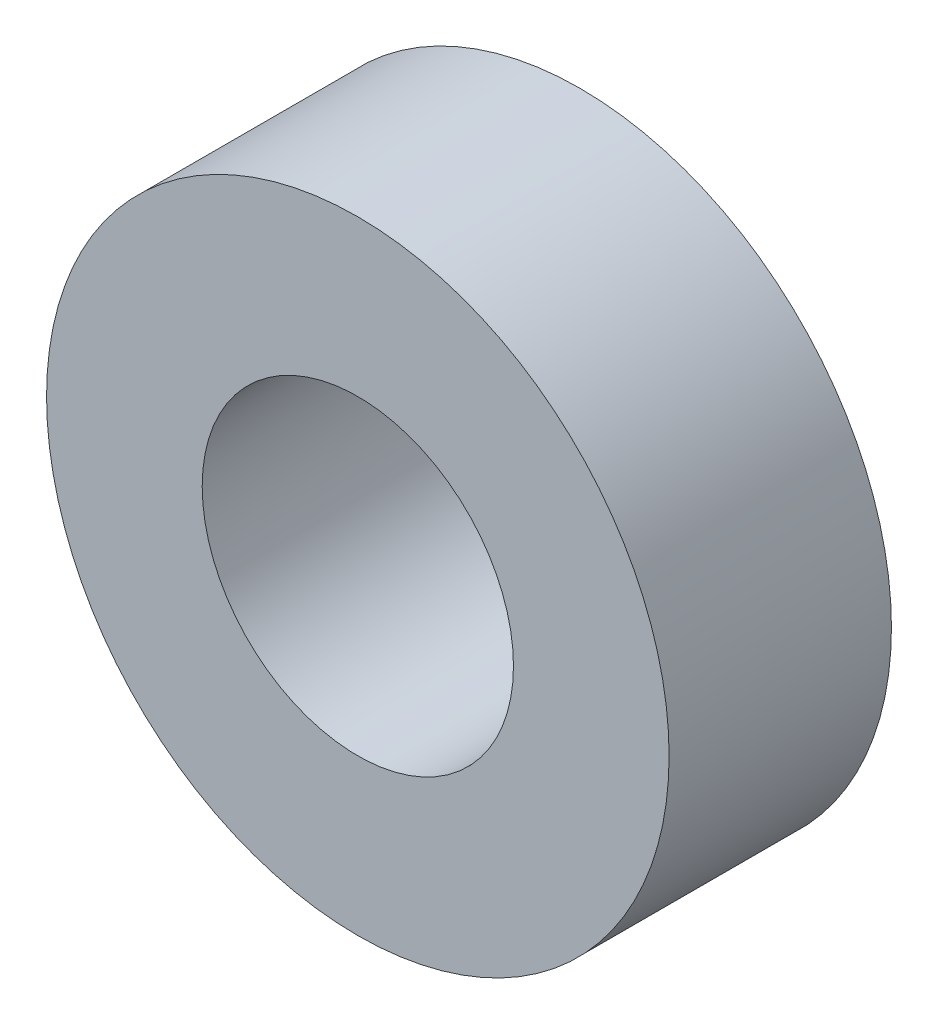
from build123d import *

# Parameters (mm, degrees)
SKETCH1_R           = 7
SKETCH1_R_2         = 3.5
BOSS_EXTRUDE1_DEPTH = 5


with BuildPart() as part:
    # Sketch1 → Boss-Extrude1 (new body)
    with BuildSketch(Plane.XY):
        Circle(SKETCH1_R)
        Circle(SKETCH1_R_2, mode=Mode.SUBTRACT)
    extrude(amount=BOSS_EXTRUDE1_DEPTH)


solid = part.part
